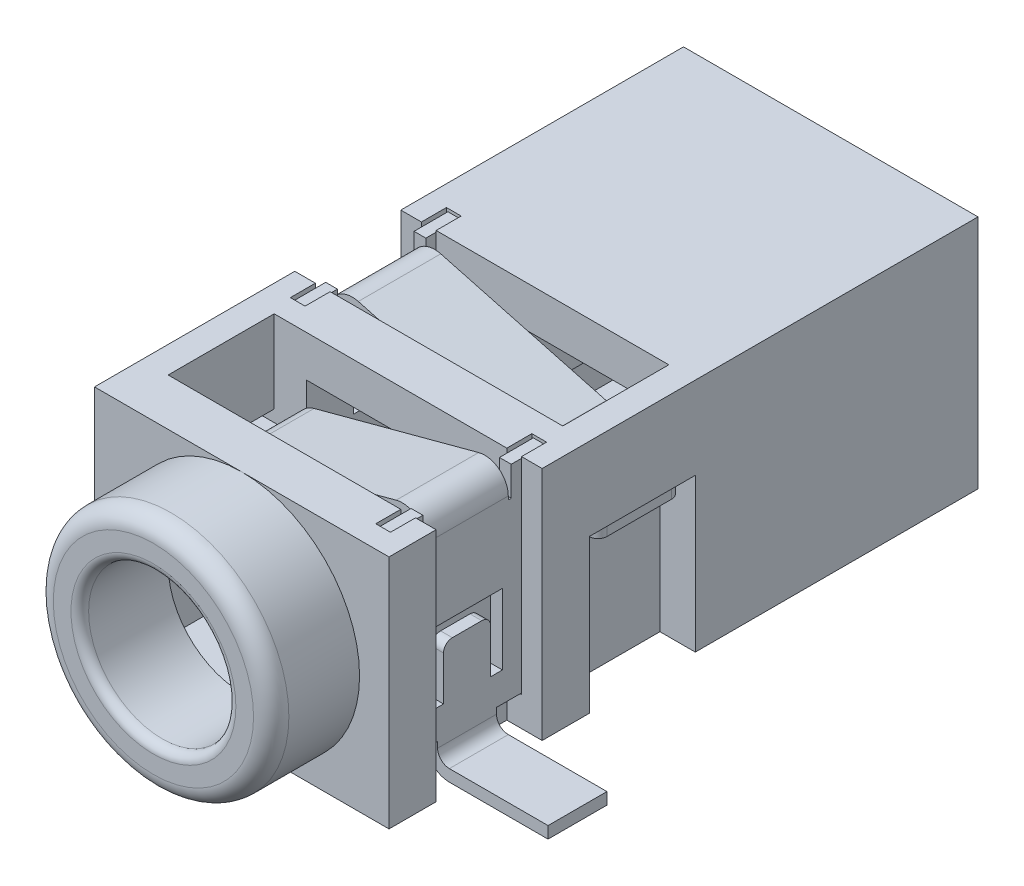
from build123d import *

# Parameters (mm, degrees)
BASE_EXTRUDE_DEPTH      = 5
BASE_EXTRUDE_DEPTH_BACK = 5
SKETCH11_W              = 5
SKETCH11_H              = 4
SKETCH12_R              = 2
SKETCH12_R_2            = 1.25
BOSS_EXTRUDE1_DEPTH     = 1.5
FILLET1_R               = 0.3
SKETCH13_R              = 1.25
CUT_EXTRUDE1_DEPTH      = 11.500000019
SKETCH14_W              = 3
SKETCH14_H              = 2.6
CUT_EXTRUDE2_DEPTH      = 10
SKETCH15_W              = 1.8
SKETCH15_H              = 4.678134156
SKETCH15_H_2            = 4
CUT_EXTRUDE3_DEPTH      = 0.6
SKETCH16_W              = 1.8
SKETCH16_H              = 5.451660208
SKETCH16_H_2            = 4
CUT_EXTRUDE4_DEPTH      = 0.6
SKETCH17_R              = 0.4
BOSS_EXTRUDE2_DEPTH     = 0.8
CHAMFER1_SIZE           = 0.1
CHAMFER2_SIZE           = 0.3
CHAMFER2_SIZE2          = 0.519615242
SKETCH18_W              = 4.55
SKETCH18_H              = 1.8
CUT_EXTRUDE5_DEPTH      = 1.6
SKETCH19_W              = 3.6
SKETCH19_H              = 0.3
CUT_EXTRUDE6_DEPTH      = 5
BOSS_EXTRUDE3_DEPTH     = 0.2
SKETCH21_W              = 3.6
SKETCH21_H              = 0.2
BOSS_EXTRUDE4_DEPTH     = 4.819615242
CUT_EXTRUDE7_REACH      = 9.706
SKETCH22_W              = 1.1
SKETCH22_H              = 2.623008354
SKETCH24_W              = 1
SKETCH24_H              = 0.2
FILLET2_R               = 0.1
SKETCH25_W              = 0.25
SKETCH25_H              = 2.65
CUT_EXTRUDE8_DEPTH      = 3.5
SKETCH46_W              = 1
SKETCH46_H              = 0.86
CUT_EXTRUDE14_DEPTH     = 0.7
SKETCH27_W              = 0.2
SKETCH27_H              = 2.65
BOSS_EXTRUDE5_DEPTH     = 3.45
SKETCH30_W              = 0.2
SKETCH30_H              = 1
SKETCH34_W              = 0.2
SKETCH34_H              = 1
CUT_EXTRUDE9_REACH      = 11.36
SKETCH35_W              = 1.5
SKETCH35_H              = 3.730505126
SKETCH37_W              = 0.2
SKETCH37_H              = 1.4
CUT_EXTRUDE10_REACH     = 11.36
CUT_EXTRUDE11_REACH     = 11.36
SKETCH40_W              = 1.5
SKETCH40_H              = 2.842324418
SKETCH43_W              = 0.2
SKETCH43_H              = 1.4
CUT_EXTRUDE12_REACH     = 11.36
FILLET3_R               = 0.15
FILLET4_R               = 0.15


with BuildPart() as part:
    # Sketch11 → Base-Extrude (new, two sides: drawn at the far end of the back side and taken through both)
    with BuildSketch(Plane.XY.offset(-BASE_EXTRUDE_DEPTH_BACK)):
        Rectangle(SKETCH11_W, SKETCH11_H)
    extrude(amount=BASE_EXTRUDE_DEPTH + BASE_EXTRUDE_DEPTH_BACK)

    # Sketch12 → Boss-Extrude1 (add)
    with BuildSketch(Plane.XY.offset(5)):
        with Locations(Location((0, 0, 0), (0, 0, 270))):
            Circle(SKETCH12_R)
        Circle(SKETCH12_R_2, mode=Mode.SUBTRACT)
    extrude(amount=BOSS_EXTRUDE1_DEPTH)

    # Fillet1
    fillet1_edges = [part.edges().sort_by_distance(p)[0] for p in [
        (0, 2, 6.5),
    ]]
    fillet(fillet1_edges, radius=FILLET1_R)

    # Sketch13 → Cut-Extrude1 (cut, through all)
    with BuildSketch(Plane.XY.offset(5)):
        Circle(SKETCH13_R)
    extrude(amount=-CUT_EXTRUDE1_DEPTH, mode=Mode.SUBTRACT)

    # Sketch14 → Cut-Extrude2 (cut)
    with BuildSketch(Plane(origin=(0, 0, -5), x_dir=(-1, 0, 0), z_dir=(0, 0, -1))):
        Rectangle(SKETCH14_W, SKETCH14_H)
    extrude(amount=-CUT_EXTRUDE2_DEPTH, mode=Mode.SUBTRACT)

    # Sketch15 → Cut-Extrude3 (cut)
    with BuildSketch(Plane(origin=(2.5, 0, 0), x_dir=(0, 0, -1), z_dir=(1, 0, 0))):
        with Locations((-0.7, -1.739067078)):
            Rectangle(SKETCH15_W, SKETCH15_H)
        with Locations((-3.3, 0)):
            Rectangle(SKETCH15_W, SKETCH15_H_2)
    extrude(amount=-CUT_EXTRUDE3_DEPTH, mode=Mode.SUBTRACT)

    # Sketch16 → Cut-Extrude4 (cut)
    with BuildSketch(Plane.ZY.offset(2.5)):
        with Locations((3.3, -2.125830104)):
            Rectangle(SKETCH16_W, SKETCH16_H)
        with Locations((0.7, 0)):
            Rectangle(SKETCH16_W, SKETCH16_H_2)
    extrude(amount=-CUT_EXTRUDE4_DEPTH, mode=Mode.SUBTRACT)

    # Sketch17 → Boss-Extrude2 (add)
    with BuildSketch(Plane.XZ.offset(2)):
        with Locations(Location((0, 3.5, 0), (0, 0, 90))):
            Circle(SKETCH17_R)
        with Locations(Location((0, -3.5, 0), (0, 0, 90))):
            Circle(SKETCH17_R)
    extrude(amount=BOSS_EXTRUDE2_DEPTH)

    # Chamfer1
    chamfer1_edges = [part.edges().sort_by_distance(p)[0] for p in [
        (0, -2.8, 3.1),
        (0, -2.8, -3.9),
    ]]
    chamfer(chamfer1_edges, length=CHAMFER1_SIZE)

    # Chamfer2
    chamfer2_edges = [part.edges().sort_by_distance(p)[0] for p in [
        (0, 1.3, -5),
        (1.5, 0, -5),
        (0, -1.3, -5),
        (-1.5, 0, -5),
    ]]
    chamfer2_side = [part.faces().sort_by_distance(p)[0] for p in [
        (-2.435968758, 0, -5),
    ]]
    chamfer(chamfer2_edges, length=CHAMFER2_SIZE, length2=CHAMFER2_SIZE2, reference=chamfer2_side[0])

    # Sketch18 → Cut-Extrude5 (cut)
    with BuildSketch(Plane(origin=(0, 2, 0), x_dir=(-1, 0, 0), z_dir=(0, 1, 0))):
        with Locations((-0.225, 3.3)):
            Rectangle(SKETCH18_W, SKETCH18_H)
        with Locations((0.225, 0.7)):
            Rectangle(SKETCH18_W, SKETCH18_H)
    extrude(amount=-CUT_EXTRUDE5_DEPTH, mode=Mode.SUBTRACT)

    # Sketch19 → Cut-Extrude6 (cut)
    with BuildSketch(Plane(origin=(0, 0, -5), x_dir=(-1, 0, 0), z_dir=(0, 0, -1))):
        with Locations((0, -1.45)):
            Rectangle(SKETCH19_W, SKETCH19_H)
    extrude(amount=-CUT_EXTRUDE6_DEPTH, mode=Mode.SUBTRACT)

    # Sketch20 → Boss-Extrude3 (add)
    with BuildSketch(Plane(origin=(-1.5, 0, 0), x_dir=(0, 0, -1), z_dir=(1, 0, 0))):
        with BuildLine():
            Line((3.880384758, 1), (3.880384758, 0.381495458))
            ThreePointArc((3.880384758, 0.381495458), (3.853589838, 0.281495458), (3.780384758, 0.208290377))
            Line((3.780384758, 0.208290377), (2.426794919, -0.573205081))
            ThreePointArc((2.426794919, -0.573205081), (2.378558728, -0.593185165), (2.326794919, -0.6))
            Line((2.326794919, -0.6), (1.380384758, -0.6))
            Line((1.380384758, -0.6), (1.380384758, -1.3))
            Line((1.380384758, -1.3), (0.380384758, -1.3))
            Line((0.380384758, -1.3), (0.380384758, 1))
            Line((0.380384758, 1), (3.880384758, 1))
        make_face()
    boss_extrude3 = extrude(amount=BOSS_EXTRUDE3_DEPTH)

    # Mirror1: Boss-Extrude3 across plane
    add(boss_extrude3.mirror(Plane(origin=(0, 0, 0), x_dir=(0, 0, 1), z_dir=(1, 0, 0))))

    # Sketch21 → Boss-Extrude4 (add)
    with BuildSketch(Plane.XY.offset(-0.380384758)):
        with Locations((0, -1.4)):
            Rectangle(SKETCH21_W, SKETCH21_H)
    extrude(amount=-BOSS_EXTRUDE4_DEPTH)

    # Sketch22 → Cut-Extrude7 (cut, up to next)
    with BuildSketch(Plane(origin=(0, -1.3, 0), x_dir=(-1, 0, 0), z_dir=(0, 1, 0)), mode=Mode.PRIVATE) as cut_extrude7_sk1:
        with Locations((0, -5.511504177)):
            Rectangle(SKETCH22_W, SKETCH22_H)
    cut_extrude7_tool1 = extrude(cut_extrude7_sk1.sketch, amount=-CUT_EXTRUDE7_REACH, mode=Mode.PRIVATE) & part.part
    add(cut_extrude7_tool1.solids().sort_by_distance((0, -1.3, -5.511504))[0], mode=Mode.SUBTRACT)

    # Boss-Sweep1: sweep along a path in Sketch23
    with BuildLine(Plane(origin=(0, 0, 0), x_dir=(0, 0, -1), z_dir=(1, 0, 0))) as boss_sweep1_path:
        Line((4.2, -1.4), (4.915071443, -1.4))
        ThreePointArc((4.915071443, -1.4), (4.988976265, -1.419470014), (5.043695382, -1.472825637))
        Line((5.043695382, -1.472825637), (5.256304618, -1.827174363))
        ThreePointArc((5.256304618, -1.827174363), (5.311023735, -1.880529986), (5.384928557, -1.9))
        Line((5.384928557, -1.9), (6.5, -1.9))
    # Sketch24 → Boss-Sweep1 (sweep)
    with BuildSketch(Plane(origin=(0, 0, -4.2), x_dir=(-1, 0, 0), z_dir=(0, 0, -1))):
        with Locations((0, -1.4)):
            Rectangle(SKETCH24_W, SKETCH24_H)
    sweep(path=boss_sweep1_path.line)

    # Fillet2
    fillet2_edges = [part.edges().sort_by_distance(p)[0] for p in [
        (-1.3, -1.3, -0.880384758),
        (1.3, -1.3, -0.880384758),
    ]]
    fillet(fillet2_edges, radius=FILLET2_R)

    # Sketch25 → Cut-Extrude8 (cut)
    with BuildSketch(Plane(origin=(0, 2, 0), x_dir=(-1, 0, 0), z_dir=(0, 1, 0))):
        with Locations((-2.025, 3.3)):
            Rectangle(SKETCH25_W, SKETCH25_H)
        with Locations((2.025, 0.7)):
            Rectangle(SKETCH25_W, SKETCH25_H)
    extrude(amount=-CUT_EXTRUDE8_DEPTH, mode=Mode.SUBTRACT)

    # Sketch46 → Cut-Extrude14 (cut)
    with BuildSketch(Plane.XZ.offset(2)):
        with Locations((1.4, 3.3)):
            Rectangle(SKETCH46_W, SKETCH46_H)
        with Locations((-1.4, 0.7)):
            Rectangle(SKETCH46_W, SKETCH46_H)
    extrude(amount=-CUT_EXTRUDE14_DEPTH, mode=Mode.SUBTRACT)

    # Sketch27 → Boss-Extrude5 (add)
    with BuildSketch(Plane(origin=(0, -1.5, 0), x_dir=(-1, 0, 0), z_dir=(0, 1, 0))):
        with Locations((-2.025, 3.3)):
            Rectangle(SKETCH27_W, SKETCH27_H)
        with Locations((2.025, 0.7)):
            Rectangle(SKETCH27_W, SKETCH27_H)
    extrude(amount=BOSS_EXTRUDE5_DEPTH)

    # Boss-Sweep2: sweep along a path in Sketch29
    with BuildLine(Plane(origin=(0, 0, 3.3), x_dir=(-1, 0, 0), z_dir=(0, 0, -1))) as boss_sweep2_path:
        Line((-2.025, -1.5), (-2.025, -1.6))
        ThreePointArc((-2.025, -1.6), (-2.112867966, -1.812132034), (-2.325, -1.9))
        Line((-2.325, -1.9), (-4, -1.9))
    # Sketch30 → Boss-Sweep2 (sweep)
    with BuildSketch(Plane.XZ.offset(1.5)):
        with Locations((2.025, 3.3)):
            Rectangle(SKETCH30_W, SKETCH30_H)
    sweep(path=boss_sweep2_path.line)

    # Boss-Sweep3: sweep along a path in Sketch33
    with BuildLine(Plane.XY.offset(0.7)) as boss_sweep3_path:
        Line((-2.025, -1.5), (-2.025, -1.6))
        ThreePointArc((-2.025, -1.6), (-2.112867966, -1.812132034), (-2.325, -1.9))
        Line((-2.325, -1.9), (-4, -1.9))
    # Sketch34 → Boss-Sweep3 (sweep)
    with BuildSketch(Plane.XZ.offset(1.5)):
        with Locations((-2.025, 0.7)):
            Rectangle(SKETCH34_W, SKETCH34_H)
    sweep(path=boss_sweep3_path.line)

    # Sketch35 → Cut-Extrude9 (cut, up to next)
    with BuildSketch(Plane(origin=(2.125, 0, 0), x_dir=(0, 0, -1), z_dir=(1, 0, 0)), mode=Mode.PRIVATE) as cut_extrude9_sk1:
        with Locations((-3.3, 3.315252563)):
            Rectangle(SKETCH35_W, SKETCH35_H)
    cut_extrude9_tool1 = extrude(cut_extrude9_sk1.sketch, amount=-CUT_EXTRUDE9_REACH, mode=Mode.PRIVATE) & part.part
    add(cut_extrude9_tool1.solids().sort_by_distance((2.125, 3.315253, 3.3))[0], mode=Mode.SUBTRACT)

    # Boss-Sweep4: sweep along a path in Sketch36
    with BuildLine(Plane(origin=(0, 0, 3.3), x_dir=(-1, 0, 0), z_dir=(0, 0, -1))) as boss_sweep4_path:
        Line((-2.025, 1.45), (-2.025, 1.509032388))
        ThreePointArc((-2.025, 1.509032388), (-1.907628429, 1.74703839), (-1.647354286, 1.798810136))
        Line((-1.647354286, 1.798810136), (1.146998017, 1.050065693))
        ThreePointArc((1.146998017, 1.050065693), (1.239566798, 1.007324432), (1.312474302, 0.936048276))
        Line((1.312474302, 0.936048276), (1.537890283, 0.624239669))
        ThreePointArc((1.537890283, 0.624239669), (1.644498727, 0.532859495), (1.781012281, 0.5))
        Line((1.781012281, 0.5), (1.9, 0.5))
        Line((1.9, 0.5), (2.45, 0.5))
    # Sketch37 → Boss-Sweep4 (sweep)
    with BuildSketch(Plane(origin=(0, 1.45, 0), x_dir=(-1, 0, 0), z_dir=(0, 1, 0))):
        with Locations((-2.025, 3.3)):
            Rectangle(SKETCH37_W, SKETCH37_H)
    sweep(path=boss_sweep4_path.line)

    # Sketch39 → Cut-Extrude10 (cut, up to next)
    with BuildSketch(Plane(origin=(2.125, 0, 0), x_dir=(0, 0, -1), z_dir=(1, 0, 0)), mode=Mode.PRIVATE) as cut_extrude10_sk1:
        with BuildLine():
            Line((-3.9, 0.2), (-3.9, -1))
            Line((-3.9, -1), (-3.7, -1))
            Line((-3.7, -1), (-3.7, -0.25))
            ThreePointArc((-3.7, -0.25), (-3.656066017, -0.143933983), (-3.55, -0.1))
            Line((-3.55, -0.1), (-3.05, -0.1))
            ThreePointArc((-3.05, -0.1), (-2.943933983, -0.143933983), (-2.9, -0.25))
            Line((-2.9, -0.25), (-2.9, -1))
            Line((-2.9, -1), (-2.7, -1))
            Line((-2.7, -1), (-2.7, 0.2))
            Line((-2.7, 0.2), (-3.9, 0.2))
        make_face()
    cut_extrude10_tool1 = extrude(cut_extrude10_sk1.sketch, amount=-CUT_EXTRUDE10_REACH, mode=Mode.PRIVATE) & part.part
    add(cut_extrude10_tool1.solids().sort_by_distance((2.125, -0.4, 3.883029))[0], mode=Mode.SUBTRACT)

    # Sketch40 → Cut-Extrude11 (cut, up to next)
    with BuildSketch(Plane.ZY.offset(2.125), mode=Mode.PRIVATE) as cut_extrude11_sk1:
        with Locations((0.7, 2.871162209)):
            Rectangle(SKETCH40_W, SKETCH40_H)
    cut_extrude11_tool1 = extrude(cut_extrude11_sk1.sketch, amount=-CUT_EXTRUDE11_REACH, mode=Mode.PRIVATE) & part.part
    add(cut_extrude11_tool1.solids().sort_by_distance((-2.125, 2.871162, 0.7))[0], mode=Mode.SUBTRACT)

    # Boss-Sweep5: sweep along a path in Sketch42
    with BuildLine(Plane.XY.offset(0.7)) as boss_sweep5_path:
        Line((-2.025, 1.45), (-2.025, 1.509032388))
        ThreePointArc((-2.025, 1.509032388), (-1.907628429, 1.74703839), (-1.647354286, 1.798810136))
        Line((-1.647354286, 1.798810136), (1.160635191, 1.046411623))
        ThreePointArc((1.160635191, 1.046411623), (1.242583261, 1.010661087), (1.310356588, 0.952348457))
        Line((1.310356588, 0.952348457), (1.6102325, 0.603974212))
        ThreePointArc((1.6102325, 0.603974212), (1.712528379, 0.52700365), (1.83759961, 0.499688793))
        Line((1.83759961, 0.499688793), (2.45, 0.499688793))
    # Sketch43 → Boss-Sweep5 (sweep)
    with BuildSketch(Plane(origin=(0, 1.45, 0), x_dir=(-1, 0, 0), z_dir=(0, 1, 0))):
        with Locations((2.025, 0.7)):
            Rectangle(SKETCH43_W, SKETCH43_H)
    sweep(path=boss_sweep5_path.line)

    # Sketch44 → Cut-Extrude12 (cut, up to next)
    with BuildSketch(Plane.ZY.offset(2.125), mode=Mode.PRIVATE) as cut_extrude12_sk1:
        with BuildLine():
            Line((0.1, -1), (0.3, -1))
            Line((0.3, -1), (0.3, -0.25))
            ThreePointArc((0.3, -0.25), (0.343933983, -0.143933983), (0.45, -0.1))
            Line((0.45, -0.1), (0.95, -0.1))
            ThreePointArc((0.95, -0.1), (1.056066017, -0.143933983), (1.1, -0.25))
            Line((1.1, -0.25), (1.1, -1))
            Line((1.1, -1), (1.3, -1))
            Line((1.3, -1), (1.3, 0.2))
            Line((1.3, 0.2), (0.1, 0.2))
            Line((0.1, 0.2), (0.1, -1))
        make_face()
    cut_extrude12_tool1 = extrude(cut_extrude12_sk1.sketch, amount=-CUT_EXTRUDE12_REACH, mode=Mode.PRIVATE) & part.part
    add(cut_extrude12_tool1.solids().sort_by_distance((-2.125, -0.983029, 0.2))[0], mode=Mode.SUBTRACT)

    # Fillet3
    fillet3_edges = [part.edges().sort_by_distance(p)[0] for p in [
        (-1.25, 0, 6.5),
    ]]
    fillet(fillet3_edges, radius=FILLET3_R)

    # Fillet4
    fillet4_edges = [part.edges().sort_by_distance(p)[0] for p in [
        (-2.45, 0.5, 2.6),
        (-2.45, 0.5, 4),
        (2.45, 0.499688793, 0),
        (2.45, 0.499688793, 1.4),
    ]]
    fillet(fillet4_edges, radius=FILLET4_R)


solid = part.part
